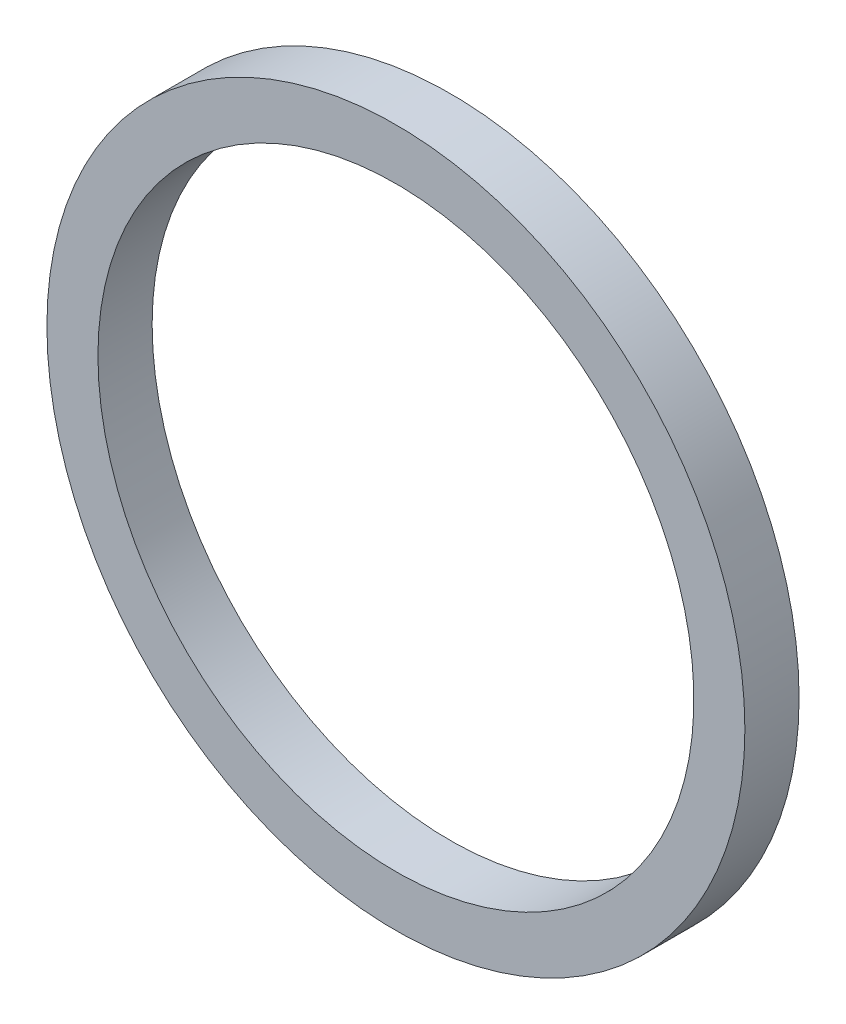
from build123d import *

# Parameters (mm, degrees)
SKETCH1_R           = 21.375
SKETCH1_R_2         = 18.25
BOSS_EXTRUDE1_DEPTH = 3.32


with BuildPart() as part:
    # Sketch1 → Boss-Extrude1 (new body)
    with BuildSketch(Plane.XY):
        with Locations(Location((0, 0, 0), (0, 0, 180))):
            Circle(SKETCH1_R)
        with Locations(Location((0, 0, 0), (0, 0, 180))):
            Circle(SKETCH1_R_2, mode=Mode.SUBTRACT)
    extrude(amount=BOSS_EXTRUDE1_DEPTH)


solid = part.part
